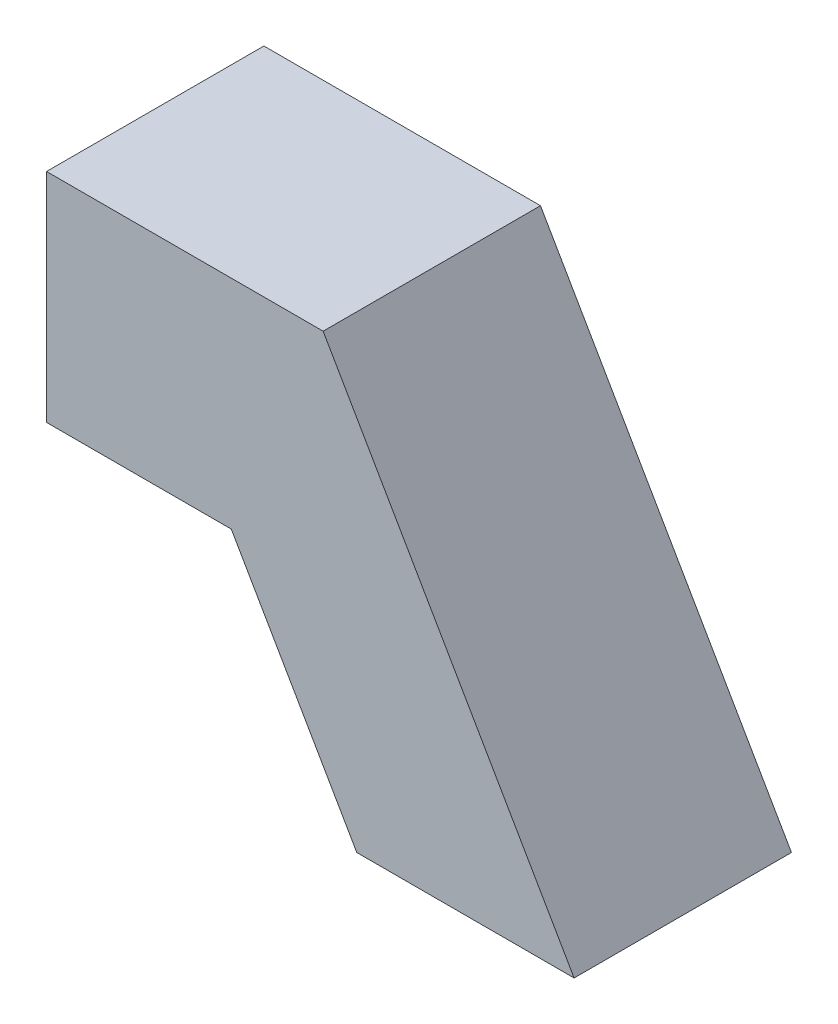
from build123d import *

# Parameters (mm, degrees)
BOSS_EXTRUDE1_DEPTH = 20


with BuildPart() as part:
    # Sketch1 → Boss-Extrude1 (new body)
    with BuildSketch(Plane.XY):
        Polygon((0, 0), (0, 20), (25.452994616, 20), (48.547005384, -20), (28.547005384, -20), (17, 0), align=None)
    extrude(amount=BOSS_EXTRUDE1_DEPTH)


solid = part.part
